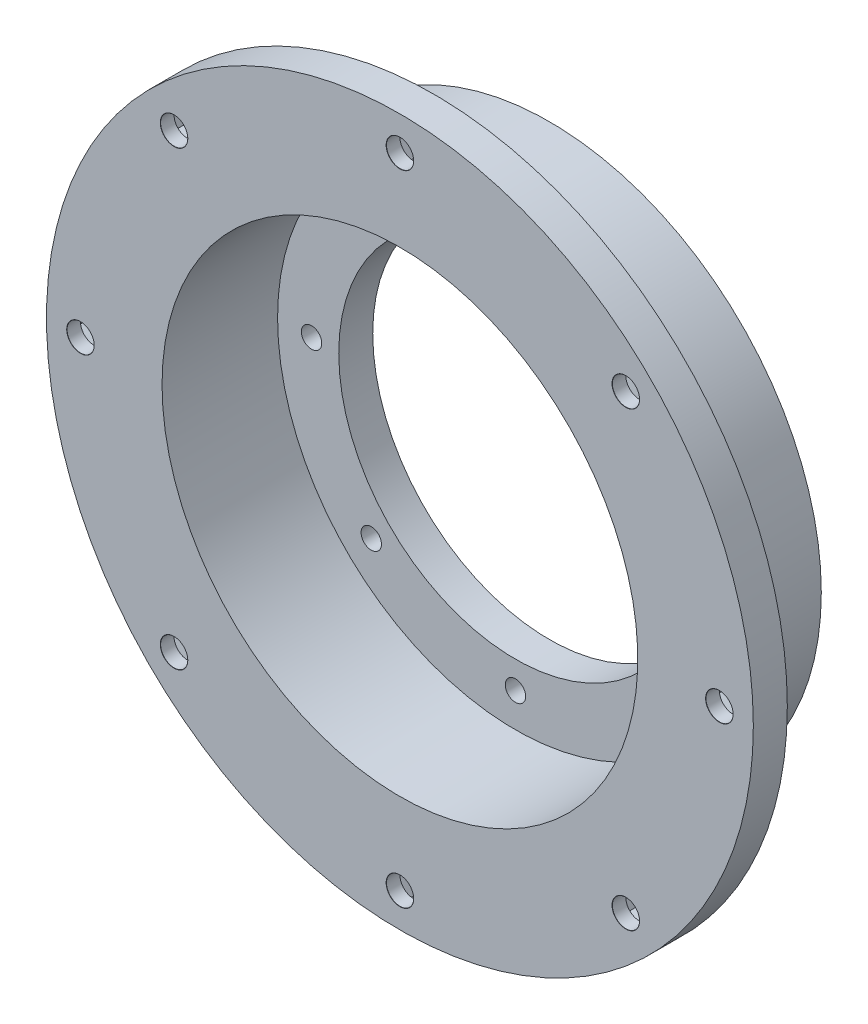
from build123d import *

# Parameters (mm, degrees)
SKETCH1_R                       = 35
SKETCH1_R_2                     = 26
BOSS_EXTRUDE1_DEPTH             = 5
F_3_0MM_DOWEL_HOLE1_D           = 3
F_3_0MM_DOWEL_HOLE1_CSINK_D     = 3.05
F_3_0MM_DOWEL_HOLE1_CSINK_ANGLE = 90
SKETCH5_R                       = 40
SKETCH5_R_2                     = 35
BOSS_EXTRUDE2_DEPTH             = 22
BOSS_EXTRUDE3_START             = -5
SKETCH6_R                       = 52
SKETCH6_R_2                     = 35
BOSS_EXTRUDE3_DEPTH             = 5
F_4_0MM_DOWEL_HOLE2_D           = 4
F_4_0MM_DOWEL_HOLE2_CSINK_D     = 4.05
F_4_0MM_DOWEL_HOLE2_CSINK_ANGLE = 90
CUT_EXTRUDE1_DEPTH              = 3


with BuildPart() as part:
    # Sketch1 → Boss-Extrude1 (new body)
    with BuildSketch(Plane.XY):
        Circle(SKETCH1_R)
        Circle(SKETCH1_R_2, mode=Mode.SUBTRACT)
    extrude(amount=BOSS_EXTRUDE1_DEPTH)

    # Ø3.0mm Dowel Hole1 (through all)
    with Locations(Plane(origin=(0, 0, 0), x_dir=(-1, 0, 0), z_dir=(0, 0, -1))):
        with Locations((21.213203436, 21.213203436), (0, 30), (-21.213203436, 21.213203436), (-30, 0), (-21.213203436, -21.213203436), (0, -30), (21.213203436, -21.213203436), (30, 0)):
            CounterSinkHole(F_3_0MM_DOWEL_HOLE1_D / 2, F_3_0MM_DOWEL_HOLE1_CSINK_D / 2, counter_sink_angle=F_3_0MM_DOWEL_HOLE1_CSINK_ANGLE)

    # Sketch5 → Boss-Extrude2 (add)
    with BuildSketch(Plane(origin=(0, 0, 0), x_dir=(-1, 0, 0), z_dir=(0, 0, -1))):
        Circle(SKETCH5_R)
        Circle(SKETCH5_R_2, mode=Mode.SUBTRACT)
    extrude(amount=-BOSS_EXTRUDE2_DEPTH)

    # Sketch6 → Boss-Extrude3 (add)
    with BuildSketch(Plane.XY.offset(22).offset(BOSS_EXTRUDE3_START)):
        Circle(SKETCH6_R)
        with Locations(Location((0, 0, 0), (0, 0, 180))):
            Circle(SKETCH6_R_2, mode=Mode.SUBTRACT)
    extrude(amount=BOSS_EXTRUDE3_DEPTH)

    # Ø4.0mm Dowel Hole2 (through all)
    with Locations(Plane.XY.offset(22)):
        with Locations((0, 47), (-33.234018716, 33.234018716), (-47, 0), (-33.234018716, -33.234018716), (0, -47), (33.234018716, -33.234018716), (47, 0), (33.234018716, 33.234018716)):
            CounterSinkHole(F_4_0MM_DOWEL_HOLE2_D / 2, F_4_0MM_DOWEL_HOLE2_CSINK_D / 2, counter_sink_angle=F_4_0MM_DOWEL_HOLE2_CSINK_ANGLE)

    # Sketch10 → Cut-Extrude1 (cut)
    with BuildSketch(Plane(origin=(0, 0, 17), x_dir=(-1, 0, 0), z_dir=(0, 0, -1))):
        Polygon((36.500005039, 29.968032392), (37.695439002, 34.429452679), (34.429452679, 37.695439002), (29.968032392, 36.500005039), (28.772598429, 32.038584753), (32.038584753, 28.772598429), align=None)
        Polygon((4.618802154, 47), (2.309401077, 51), (-2.309401077, 51), (-4.618802154, 47), (-2.309401077, 43), (2.309401077, 43), align=None)
        Polygon((47, -4.618802154), (51, -2.309401077), (51, 2.309401077), (47, 4.618802154), (43, 2.309401077), (43, -2.309401077), align=None)
        Polygon((29.968032392, -36.500005039), (34.429452679, -37.695439002), (37.695439002, -34.429452679), (36.500005039, -29.968032392), (32.038584753, -28.772598429), (28.772598429, -32.038584753), align=None)
        Polygon((-4.618802154, -47), (-2.309401077, -51), (2.309401077, -51), (4.618802154, -47), (2.309401077, -43), (-2.309401077, -43), align=None)
        Polygon((-36.500005039, -29.968032392), (-37.695439002, -34.429452679), (-34.429452679, -37.695439002), (-29.968032392, -36.500005039), (-28.772598429, -32.038584753), (-32.038584753, -28.772598429), align=None)
        Polygon((-47, 4.618802154), (-51, 2.309401077), (-51, -2.309401077), (-47, -4.618802154), (-43, -2.309401077), (-43, 2.309401077), align=None)
        Polygon((-29.968032392, 36.500005039), (-34.429452679, 37.695439002), (-37.695439002, 34.429452679), (-36.500005039, 29.968032392), (-32.038584753, 28.772598429), (-28.772598429, 32.038584753), align=None)
    extrude(amount=-CUT_EXTRUDE1_DEPTH, mode=Mode.SUBTRACT)


solid = part.part
